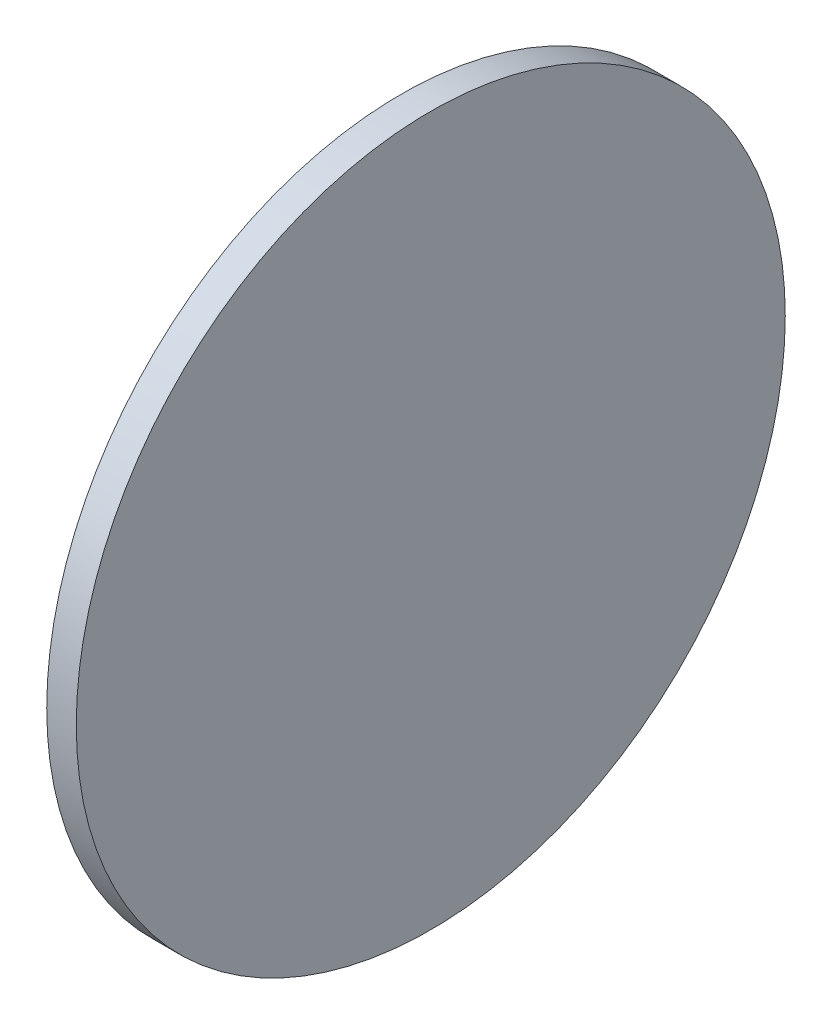
from build123d import *

# Parameters (mm, degrees)
SKETCH1_R           = 12
BOSS_EXTRUDE1_DEPTH = 1


with BuildPart() as part:
    # Sketch1 → Boss-Extrude1 (new body)
    with BuildSketch(Plane(origin=(0, 0, 0), x_dir=(0, 0, -1), z_dir=(1, 0, 0))):
        Circle(SKETCH1_R)
    extrude(amount=BOSS_EXTRUDE1_DEPTH)


solid = part.part
